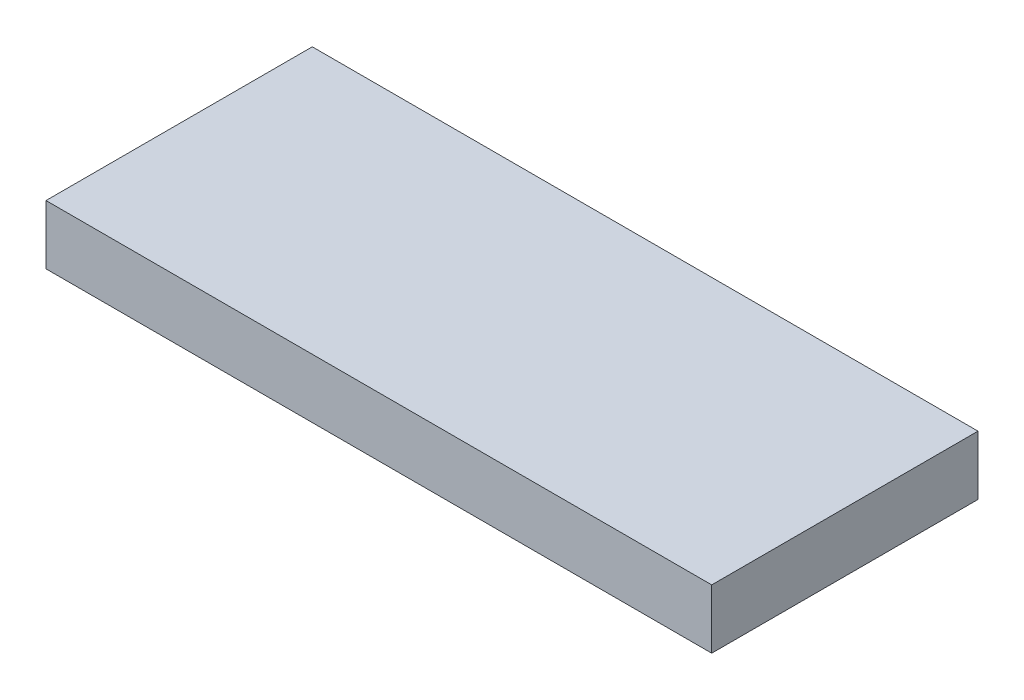
from build123d import *

# Parameters (mm, degrees)
SKETCH1_W           = 450
SKETCH1_H           = 180
BOSS_EXTRUDE1_DEPTH = 40


with BuildPart() as part:
    # Sketch1 → Boss-Extrude1 (new body)
    with BuildSketch(Plane(origin=(0, 0, 0), x_dir=(1, 0, 0), z_dir=(0, 1, 0))):
        Rectangle(SKETCH1_W, SKETCH1_H)
    extrude(amount=BOSS_EXTRUDE1_DEPTH)


solid = part.part
